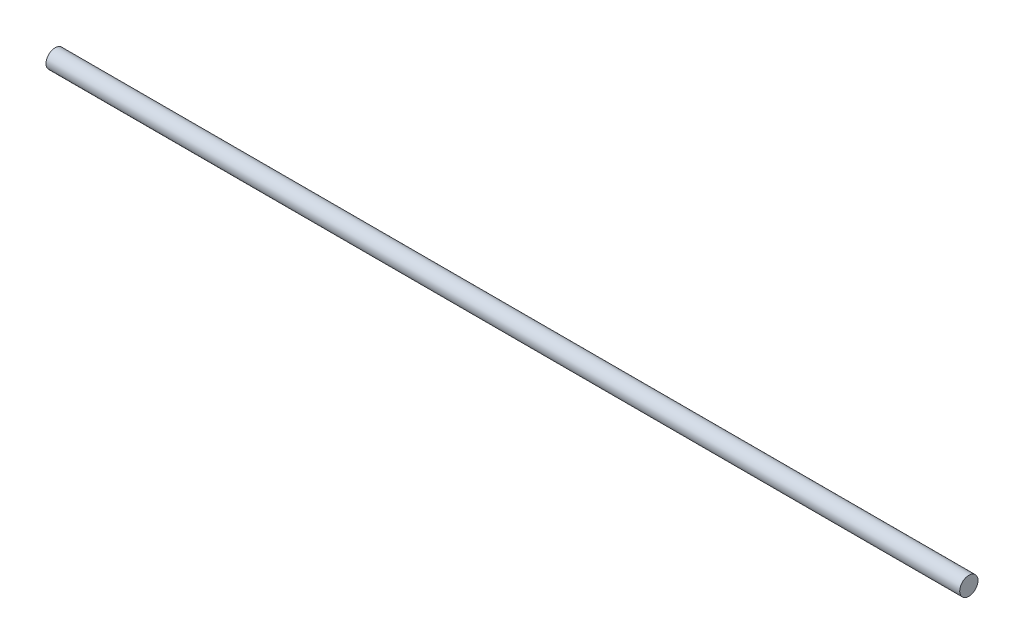
from build123d import *

# Parameters (mm, degrees)
CROQUIS1_R              = 4
SALIENTE_EXTRUIR1_DEPTH = 400


with BuildPart() as part:
    # Croquis1 → Saliente-Extruir1 (new body)
    with BuildSketch(Plane(origin=(0, 0, 0), x_dir=(0, 0, -1), z_dir=(1, 0, 0))):
        Circle(CROQUIS1_R)
    extrude(amount=SALIENTE_EXTRUIR1_DEPTH)


solid = part.part
